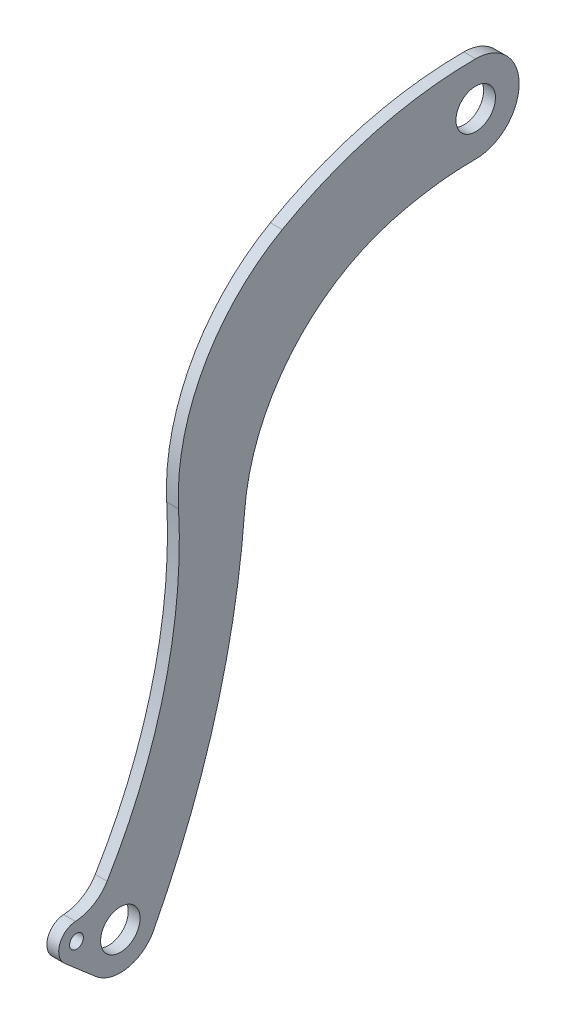
from build123d import *

# Parameters (mm, degrees)
BOSS_EXTRUDE1_DEPTH = 1.5
SKETCH2_R           = 5
CUT_EXTRUDE1_DEPTH  = 142.810613143
SKETCH4_R           = 1.75
BOSS_EXTRUDE2_DEPTH = 3


with BuildPart() as part:
    # Sketch1 → Boss-Extrude1 (new, symmetric)
    with BuildSketch(Plane(origin=(0, 0, 0), x_dir=(0, 0, -1), z_dir=(1, 0, 0))):
        with BuildLine():
            ThreePointArc((0, 79), (11, 90), (0, 101))
            ThreePointArc((0, 101), (-25.350874614, 97.701945149), (-49.014054674, 88.027343403))
            ThreePointArc((-49.014054674, 88.027343403), (-68.978437503, 67.692387852), (-75.252234106, 39.89442974))
            ThreePointArc((-75.252234106, 39.89442974), (-79.876334442, -1.725579257), (-97.797422275, -39.573195612))
            ThreePointArc((-97.797422275, -39.573195612), (-94.917356951, -53.128320897), (-81.574017035, -49.387802533))
            ThreePointArc((-81.574017035, -49.387802533), (-66.010073659, -10.395208993), (-58.530464131, 30.917187762))
            ThreePointArc((-58.530464131, 30.917187762), (-46.946256543, 59.483246729), (-21.037120215, 76.184451628))
            ThreePointArc((-21.037120215, 76.184451628), (-10.612348227, 78.292988751), (0, 79))
        make_face()
    extrude(amount=BOSS_EXTRUDE1_DEPTH, both=True)

    # Sketch2 → Cut-Extrude1 (cut, through all)
    with BuildSketch(Plane(origin=(1.5, 0, 0), x_dir=(0, 0, -1), z_dir=(1, 0, 0))):
        with Locations((0, 90)):
            Circle(SKETCH2_R)
        with Locations((-90, -45)):
            Circle(SKETCH2_R)
    extrude(amount=-CUT_EXTRUDE1_DEPTH, mode=Mode.SUBTRACT)

    # Sketch4 → Boss-Extrude2 (add)
    with BuildSketch(Plane(origin=(1.5, 0, 0), x_dir=(0, 0, -1), z_dir=(1, 0, 0))):
        with BuildLine():
            Line((-104.046842635, -45.431522879), (-96.203913002, -52.194544007))
            ThreePointArc((-96.203913002, -52.194544007), (-96.739012984, -42.16802815), (-93.346869933, -32.717593358))
            ThreePointArc((-93.346869933, -32.717593358), (-96.754563068, -36.116875497), (-101.355592309, -37.530389374))
            ThreePointArc((-101.355592309, -37.530389374), (-105.36782436, -40.572667885), (-104.046842635, -45.431522879))
        make_face()
        with Locations((-101.108147002, -42.023580981)):
            Circle(SKETCH4_R, mode=Mode.SUBTRACT)
    extrude(amount=-BOSS_EXTRUDE2_DEPTH)


solid = part.part
